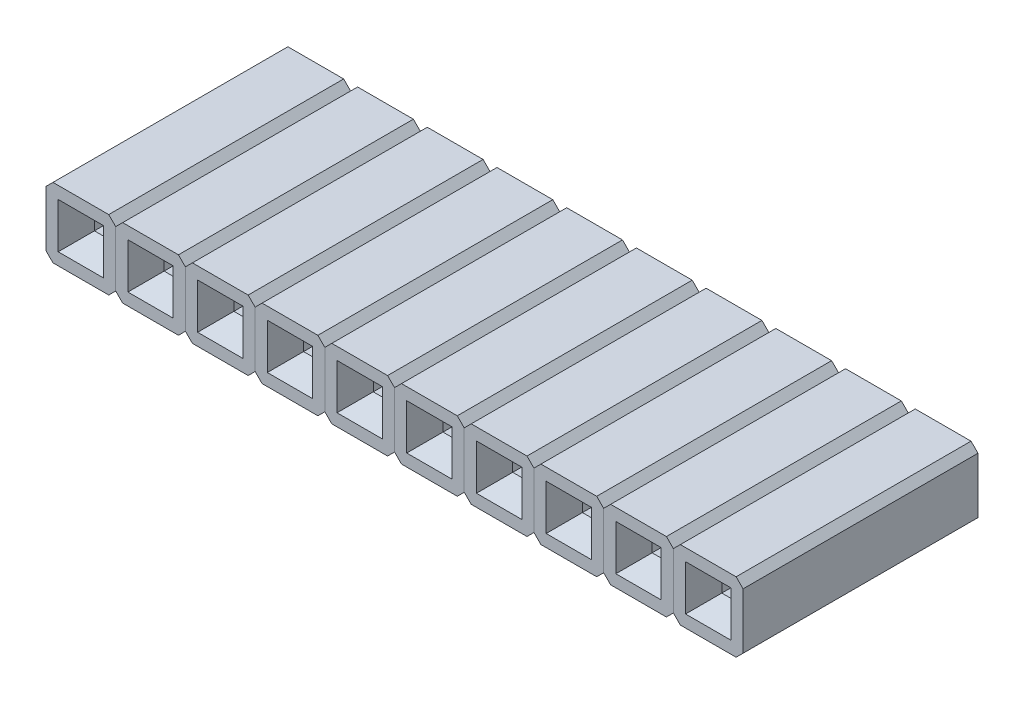
from build123d import *

# Parameters (mm, degrees)
SKETCH1_W           = 2.54
SKETCH1_H           = 2.54
BOSS_EXTRUDE1_DEPTH = 8.5598
SKETCH2_W           = 0.635
SKETCH2_H           = 0.635
CUT_EXTRUDE1_DEPTH  = 6.35
CHAMFER1_SIZE       = 0.508
CHAMFER1_SIZE2      = 0.812969941
CHAMFER2_SIZE       = 0.254
LPATTERN1_COUNT     = 10
LPATTERN1_PITCH     = 2.54


with BuildPart() as part:
    # Sketch1 → Boss-Extrude1 (new body)
    with BuildSketch(Plane.XY):
        with Locations((1.27, 1.27)):
            Rectangle(SKETCH1_W, SKETCH1_H)
    extrude(amount=BOSS_EXTRUDE1_DEPTH)

    # Sketch2 → Cut-Extrude1 (cut)
    with BuildSketch(Plane.XY.offset(8.5598)):
        with Locations((1.27, 1.27)):
            Rectangle(SKETCH2_W, SKETCH2_H)
    extrude(amount=-CUT_EXTRUDE1_DEPTH, mode=Mode.SUBTRACT)

    # Chamfer1
    chamfer1_edges = [part.edges().sort_by_distance(p)[0] for p in [
        (1.5875, 1.27, 8.5598),
        (1.27, 1.5875, 8.5598),
        (0.9525, 1.27, 8.5598),
        (1.27, 0.9525, 8.5598),
    ]]
    chamfer1_side = [part.faces().sort_by_distance(p)[0] for p in [
        (1.27, 0.035921024, 8.5598),
    ]]
    chamfer(chamfer1_edges, length=CHAMFER1_SIZE, length2=CHAMFER1_SIZE2, reference=chamfer1_side[0])

    # Chamfer2
    chamfer2_edges = [part.edges().sort_by_distance(p)[0] for p in [
        (0, 2.54, 4.2799),
        (2.54, 2.54, 4.2799),
        (2.54, 0, 4.2799),
        (0, 0, 4.2799),
    ]]
    chamfer(chamfer2_edges, length=CHAMFER2_SIZE)


with BuildPart() as lpattern1_1:
    # LPattern1: pattern copy
    add(part.part.moved(Location(Vector(-1, 0, 0) * (1 * LPATTERN1_PITCH))))


with BuildPart() as lpattern1_2:
    # LPattern1: pattern copy
    add(part.part.moved(Location(Vector(-1, 0, 0) * (2 * LPATTERN1_PITCH))))


with BuildPart() as lpattern1_3:
    # LPattern1: pattern copy
    add(part.part.moved(Location(Vector(-1, 0, 0) * (3 * LPATTERN1_PITCH))))


with BuildPart() as lpattern1_4:
    # LPattern1: pattern copy
    add(part.part.moved(Location(Vector(-1, 0, 0) * (4 * LPATTERN1_PITCH))))


with BuildPart() as lpattern1_5:
    # LPattern1: pattern copy
    add(part.part.moved(Location(Vector(-1, 0, 0) * (5 * LPATTERN1_PITCH))))


with BuildPart() as lpattern1_6:
    # LPattern1: pattern copy
    add(part.part.moved(Location(Vector(-1, 0, 0) * (6 * LPATTERN1_PITCH))))


with BuildPart() as lpattern1_7:
    # LPattern1: pattern copy
    add(part.part.moved(Location(Vector(-1, 0, 0) * (7 * LPATTERN1_PITCH))))


with BuildPart() as lpattern1_8:
    # LPattern1: pattern copy
    add(part.part.moved(Location(Vector(-1, 0, 0) * (8 * LPATTERN1_PITCH))))


with BuildPart() as lpattern1_9:
    # LPattern1: pattern copy
    add(part.part.moved(Location(Vector(-1, 0, 0) * (9 * LPATTERN1_PITCH))))


solid = Compound([part.part, lpattern1_1.part, lpattern1_2.part, lpattern1_3.part, lpattern1_4.part, lpattern1_5.part, lpattern1_6.part, lpattern1_7.part, lpattern1_8.part, lpattern1_9.part])
